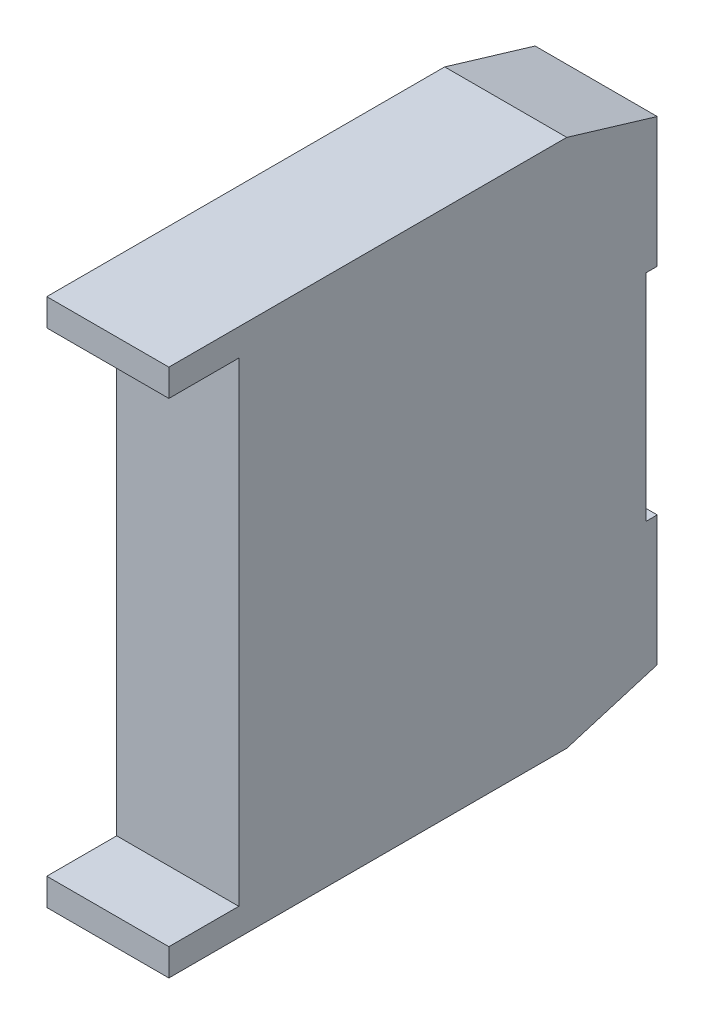
from build123d import *

# Parameters (mm, degrees)
EXTRUDE_1_DEPTH      = 4.5
EXTRUDE_1_DEPTH_BACK = 4.5


with BuildPart() as part:
    # 草图1 → 凸台-拉伸1 (new, two sides: drawn at the far end of the back side and taken through both)
    with BuildSketch(Plane(origin=(0, 0, 0), x_dir=(0, 0, -1), z_dir=(1, 0, 0)).offset(-EXTRUDE_1_DEPTH_BACK)):
        Polygon((0, 17.5), (0, 19.5), (29.3330418, 19.5), (36, 17.5), (36, 7.934061775), (35.180915007, 7.934061775), (35.180915007, -7.934061775), (36, -7.934061775), (36, -17.5), (29.3330418, -19.5), (0, -19.5), (0, -17.5), (5.153343524, -17.5), (5.153343524, 17.5), align=None)
    extrude(amount=EXTRUDE_1_DEPTH + EXTRUDE_1_DEPTH_BACK)


solid = part.part
